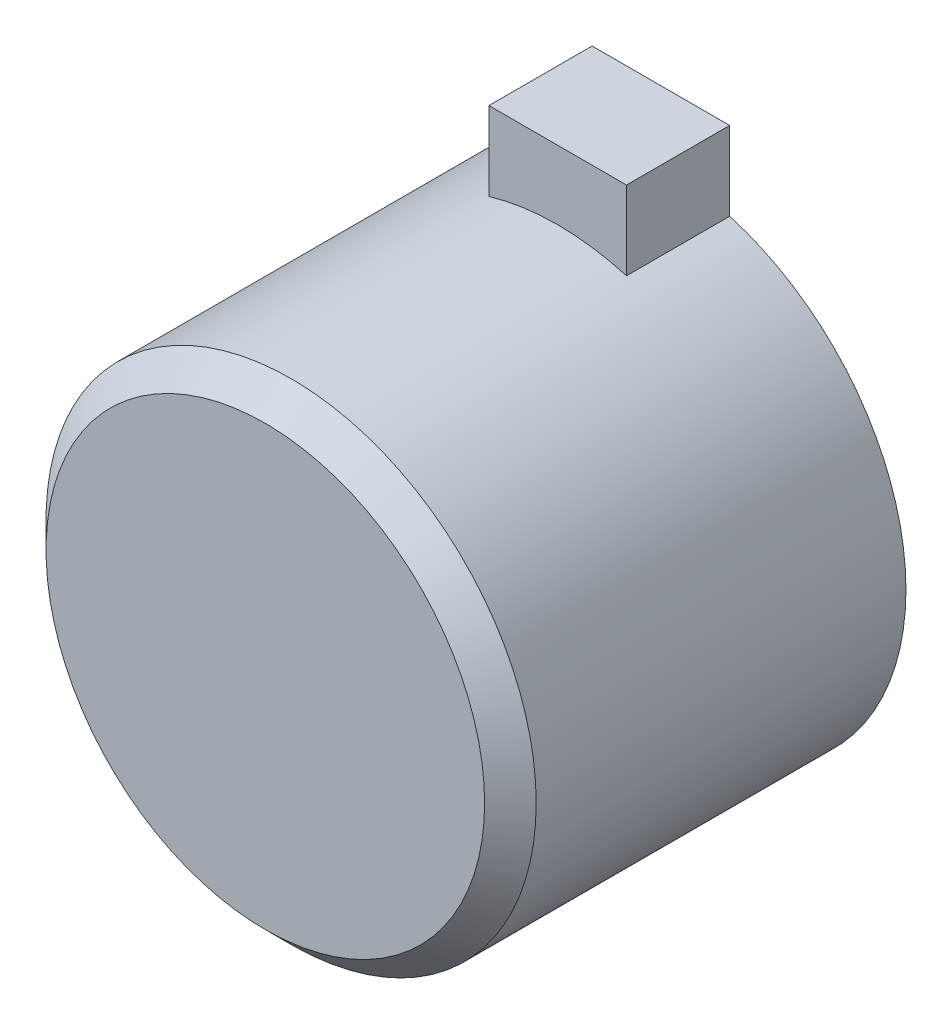
from build123d import *

# Parameters (mm, degrees)
SK_REARHOLE_R           = 1.25
REAR_TAPPED_HOLE_DEPTH  = 8
REAR_HOLE_PATTERN_COUNT = 4
SK_CONNECTOR_W          = 16
SK_CONNECTOR_H          = 12
CONNECTOR_ZONE_DEPTH    = 12


with BuildPart() as part:
    # SK_Body → Housing_Body (revolve)
    with BuildSketch(Plane(origin=(0, 0, 0), x_dir=(1, 0, 0), z_dir=(0, 1, 0))):
        Polygon((0, 0), (25.5, 0), (28.5, 3), (28.5, 46), (25.5, 46), (0, 46), align=None)
    revolve(axis=Axis((0, 0, 10), (0, 0, -1)))

    # SK_RearHole → Rear_Tapped_Hole (cut)
    with BuildSketch(Plane.XY.offset(-46)):
        with Locations((23, 0)):
            Circle(SK_REARHOLE_R)
    rear_tapped_hole = extrude(amount=REAR_TAPPED_HOLE_DEPTH, mode=Mode.SUBTRACT)

    # Rear_Hole_Pattern: Rear_Tapped_Hole ×4 about axis
    rear_hole_pattern_axis = Axis((0, 0, -48.3), (0, 0, 1))
    for i in range(1, REAR_HOLE_PATTERN_COUNT):
        add(rear_tapped_hole.rotate(rear_hole_pattern_axis, i * 360 / REAR_HOLE_PATTERN_COUNT), mode=Mode.SUBTRACT)

    # SK_Connector → Connector_Zone (add)
    with BuildSketch(Plane.XY.offset(-46)):
        with Locations((0, 30.5)):
            Rectangle(SK_CONNECTOR_W, SK_CONNECTOR_H)
    extrude(amount=CONNECTOR_ZONE_DEPTH)


solid = part.part
